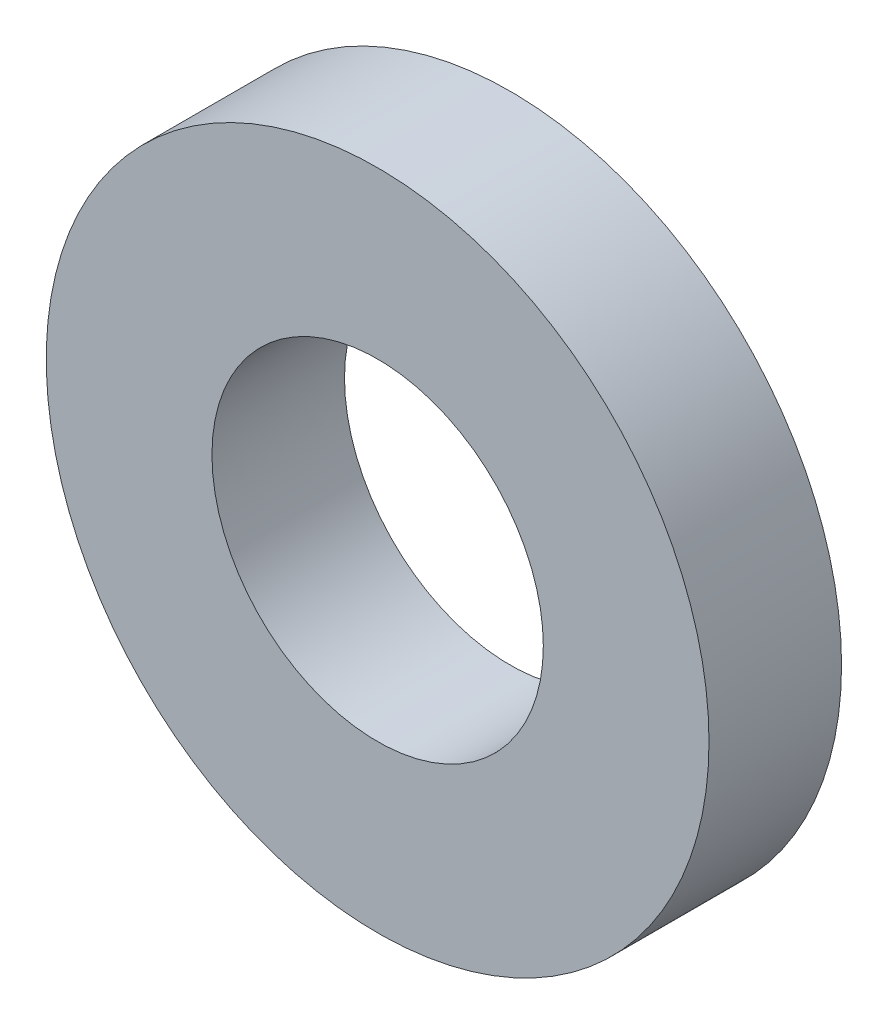
from build123d import *

# Parameters (mm, degrees)
SKETCH1_R           = 2.5
SKETCH1_R_2         = 1.25
BOSS_EXTRUDE1_DEPTH = 0.5


with BuildPart() as part:
    # Sketch1 → Boss-Extrude1 (new, symmetric)
    with BuildSketch(Plane.XY):
        Circle(SKETCH1_R)
        Circle(SKETCH1_R_2, mode=Mode.SUBTRACT)
    extrude(amount=BOSS_EXTRUDE1_DEPTH, both=True)


solid = part.part
